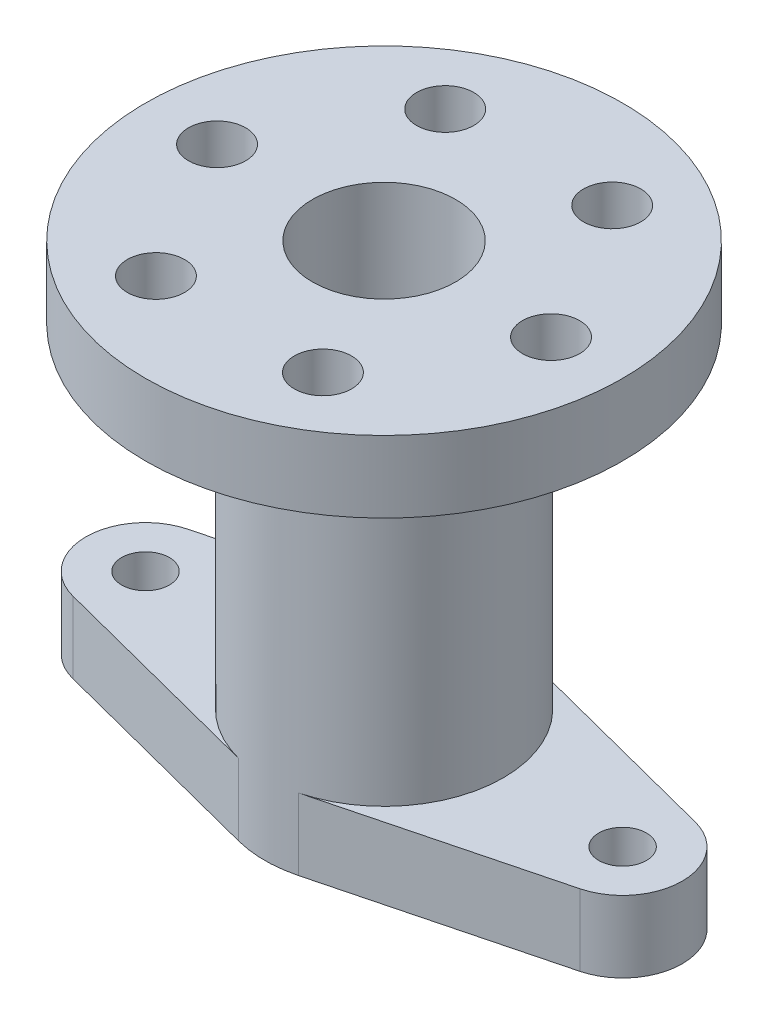
from build123d import *
from build123d.topology import SkipClean

# Parameters (mm, degrees)
BOSS_EXTRUDE1_DEPTH = 15
SKETCH2_R           = 25
BOSS_EXTRUDE2_DEPTH = 70
SKETCH3_R           = 50
BOSS_EXTRUDE3_DEPTH = 15
HOLE1_D             = 30
HOLE2_D             = 12
HOLE2_DEPTH         = 15
CIRPATTERN1_COUNT   = 6
HOLE3_D             = 10
HOLE3_DEPTH         = 15


with BuildPart() as part:
    # Sketch1 → Boss-Extrude1 (new body)
    with BuildSketch(Plane(origin=(0, 0, 0), x_dir=(1, 0, 0), z_dir=(0, 1, 0))):
        with BuildLine():
            Line((-53.125, 12.103072957), (-6.25, 24.206145914))
            ThreePointArc((-6.25, 24.206145914), (0, 25), (6.25, 24.206145914))
            Line((6.25, 24.206145914), (53.125, 12.103072957))
            ThreePointArc((53.125, 12.103072957), (62.5, 0), (53.125, -12.103072957))
            Line((53.125, -12.103072957), (6.25, -24.206145914))
            ThreePointArc((6.25, -24.206145914), (0, -25), (-6.25, -24.206145914))
            Line((-6.25, -24.206145914), (-53.125, -12.103072957))
            ThreePointArc((-53.125, -12.103072957), (-62.5, 0), (-53.125, 12.103072957))
        make_face()
    extrude(amount=BOSS_EXTRUDE1_DEPTH)

    # Sketch2 → Boss-Extrude2 (add)
    with BuildSketch(Plane(origin=(0, 15, 0), x_dir=(1, 0, 0), z_dir=(0, 1, 0))):
        with Locations(Location((0, 0, 0), (0, 0, 104.477512186))):
            Circle(SKETCH2_R)
    extrude(amount=BOSS_EXTRUDE2_DEPTH)

    # Sketch3 → Boss-Extrude3 (add)
    with SkipClean():  # the faces are left unmerged after this step: merging them gives an invalid solid
        with BuildSketch(Plane(origin=(0, 85, 0), x_dir=(1, 0, 0), z_dir=(0, 1, 0))):
            with Locations(Location((0, 0, 0), (0, 0, 270))):
                Circle(SKETCH3_R)
        extrude(amount=BOSS_EXTRUDE3_DEPTH)

    # Hole1 (through all)
    with Locations(Plane(origin=(0, 100, 0), x_dir=(1, 0, 0), z_dir=(0, 1, 0))):
        with Locations((0, 0)):
            Hole(HOLE1_D / 2)

    # Hole2
    with Locations(Plane(origin=(0, 100, 0), x_dir=(1, 0, 0), z_dir=(0, 1, 0))):
        with Locations((35, 0)):
            hole2 = Hole(HOLE2_D / 2, depth=HOLE2_DEPTH)

    # CirPattern1: Hole2 ×6 about axis
    with SkipClean():  # the faces are left unmerged after this step: merging them gives an invalid solid
        cirpattern1_axis = Axis((0, 0, 0), (0, 1, 0))
        for i in range(1, CIRPATTERN1_COUNT):
            add(hole2.rotate(cirpattern1_axis, i * 360 / CIRPATTERN1_COUNT), mode=Mode.SUBTRACT)

    # Hole3
    with Locations(Plane(origin=(0, 0, 0), x_dir=(-1, 0, 0), z_dir=(0, -1, 0))):
        with Locations((50, 0), (-50, 0)):
            Hole(HOLE3_D / 2, depth=HOLE3_DEPTH)


solid = part.part
